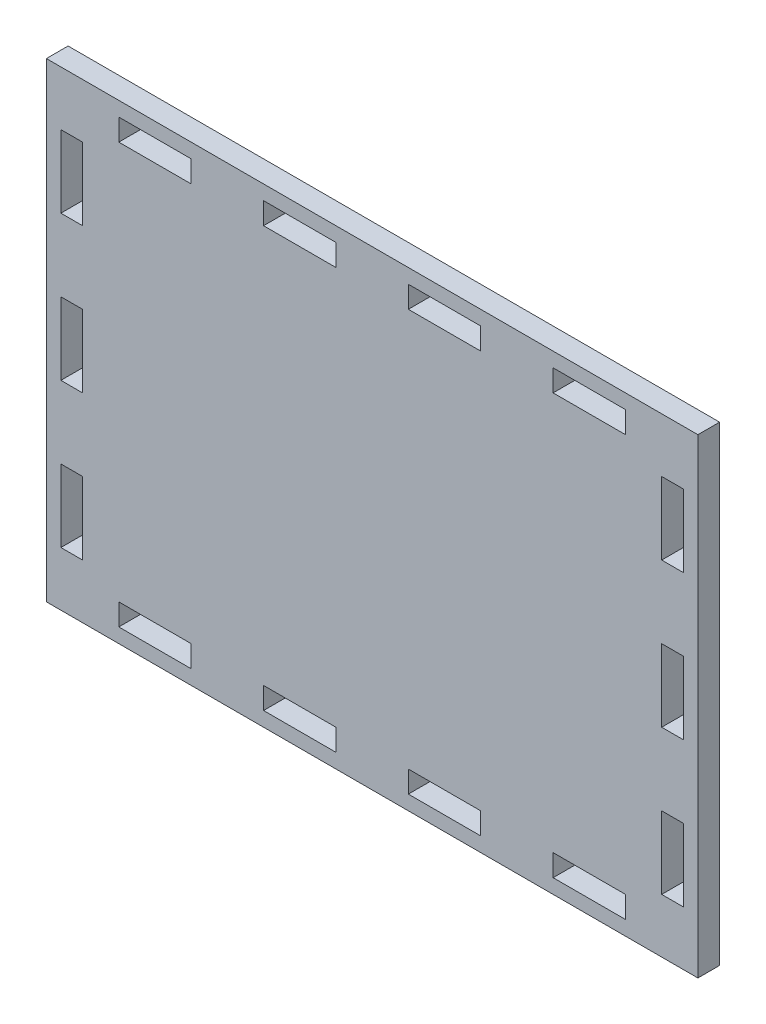
from build123d import *

# Parameters (mm, degrees)
SKETCH_1_W      = 90
SKETCH_1_H      = 65
SKETCH_1_W_2    = 10
SKETCH_1_H_2    = 3
SKETCH_1_W_3    = 3
SKETCH_1_H_3    = 10
EXTRUDE_1_DEPTH = 3


with BuildPart() as part:
    # 草图1 → 凸台-拉伸1 (new body)
    with BuildSketch(Plane.XY):
        Rectangle(SKETCH_1_W, SKETCH_1_H)
        with Locations((-10, 29)):
            Rectangle(SKETCH_1_W_2, SKETCH_1_H_2, mode=Mode.SUBTRACT)
        with Locations((-30, 29)):
            Rectangle(SKETCH_1_W_2, SKETCH_1_H_2, mode=Mode.SUBTRACT)
        with Locations((-41.5, 20)):
            Rectangle(SKETCH_1_W_3, SKETCH_1_H_3, mode=Mode.SUBTRACT)
        with Locations((10, 29)):
            Rectangle(SKETCH_1_W_2, SKETCH_1_H_2, mode=Mode.SUBTRACT)
        with Locations((30, 29)):
            Rectangle(SKETCH_1_W_2, SKETCH_1_H_2, mode=Mode.SUBTRACT)
        with Locations((-41.5, 0)):
            Rectangle(SKETCH_1_W_3, SKETCH_1_H_3, mode=Mode.SUBTRACT)
        with Locations((-41.5, -20)):
            Rectangle(SKETCH_1_W_3, SKETCH_1_H_3, mode=Mode.SUBTRACT)
        with Locations((41.5, -20)):
            Rectangle(SKETCH_1_W_3, SKETCH_1_H_3, mode=Mode.SUBTRACT)
        with Locations((41.5, 0)):
            Rectangle(SKETCH_1_W_3, SKETCH_1_H_3, mode=Mode.SUBTRACT)
        with Locations((41.5, 20)):
            Rectangle(SKETCH_1_W_3, SKETCH_1_H_3, mode=Mode.SUBTRACT)
        with Locations((30, -29)):
            Rectangle(SKETCH_1_W_2, SKETCH_1_H_2, mode=Mode.SUBTRACT)
        with Locations((10, -29)):
            Rectangle(SKETCH_1_W_2, SKETCH_1_H_2, mode=Mode.SUBTRACT)
        with Locations((-10, -29)):
            Rectangle(SKETCH_1_W_2, SKETCH_1_H_2, mode=Mode.SUBTRACT)
        with Locations((-30, -29)):
            Rectangle(SKETCH_1_W_2, SKETCH_1_H_2, mode=Mode.SUBTRACT)
    extrude(amount=EXTRUDE_1_DEPTH)


solid = part.part
